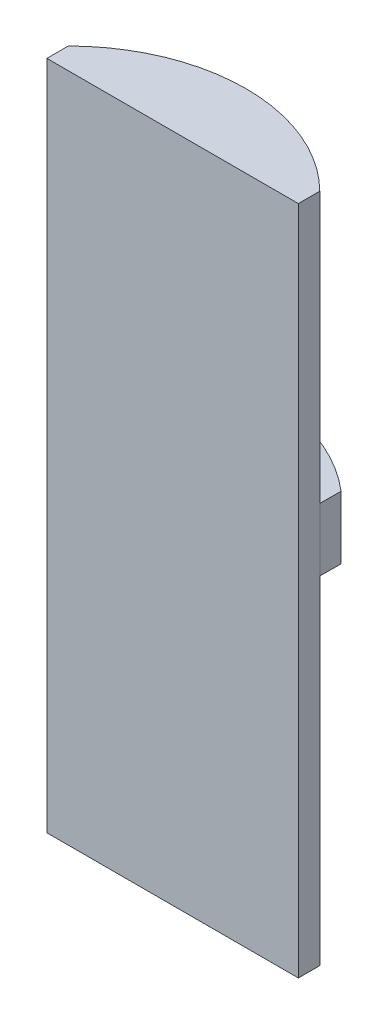
from build123d import *

# Parameters (mm, degrees)
BOSS_EXTRUDE1_DEPTH = 29
BOSS_EXTRUDE3_START = -3
BOSS_EXTRUDE3_DEPTH = 3
BOSS_EXTRUDE4_DEPTH = 29
SKETCH6_W           = 15.595785808
SKETCH6_H           = 9.872798586
CUT_EXTRUDE1_DEPTH  = 2
BOSS_EXTRUDE5_DEPTH = 5


with BuildPart() as part:
    # Sketch2 → Boss-Extrude1 (new body)
    with BuildSketch(Plane(origin=(0, 0, 0), x_dir=(1, 0, 0), z_dir=(0, 1, 0))):
        with BuildLine():
            Line((-6, 6.020797289), (-6, 5))
            Line((-6, 5), (-5.921359641, 5))
            ThreePointArc((-5.921359641, 5), (0, 7.75), (5.921359641, 5))
            Line((5.921359641, 5), (6, 5))
            Line((6, 5), (6, 6.020797289))
            ThreePointArc((6, 6.020797289), (0, 8.5), (-6, 6.020797289))
        make_face()
    extrude(amount=BOSS_EXTRUDE1_DEPTH)

    # Sketch4 → Boss-Extrude3 (add)
    with BuildSketch(Plane(origin=(0, 21.1, 0), x_dir=(1, 0, 0), z_dir=(0, 1, 0)).offset(BOSS_EXTRUDE3_START)):
        with BuildLine():
            Line((6, 6.020797289), (6.006787511, 7.03427351))
            ThreePointArc((6.006787511, 7.03427351), (0.004460918, 9.249998925), (-6, 7.040063921))
            Line((-6, 7.040063921), (-6, 6.020797289))
            ThreePointArc((-6, 6.020797289), (0, 8.5), (6, 6.020797289))
        make_face()
    extrude(amount=BOSS_EXTRUDE3_DEPTH)

    # Sketch5 → Boss-Extrude4 (add)
    with BuildSketch(Plane.XZ):
        with BuildLine():
            Line((-5.921359641, -5), (5.921359641, -5))
            ThreePointArc((5.921359641, -5), (0, -7.75), (-5.921359641, -5))
        make_face()
    extrude(amount=-BOSS_EXTRUDE4_DEPTH)

    # Sketch6 → Cut-Extrude1 (cut)
    with BuildSketch(Plane.XZ):
        with Locations((-0.763992961, -6.245386966)):
            Rectangle(SKETCH6_W, SKETCH6_H)
    extrude(amount=-CUT_EXTRUDE1_DEPTH, mode=Mode.SUBTRACT)

    # Sketch7 → Boss-Extrude5 (add)
    with BuildSketch(Plane(origin=(0, 29, 0), x_dir=(1, 0, 0), z_dir=(0, 1, 0))):
        with BuildLine():
            Line((-6, 5), (6, 5))
            Line((6, 5), (6, 6.020797289))
            ThreePointArc((6, 6.020797289), (0, 8.5), (-6, 6.020797289))
            Line((-6, 6.020797289), (-6, 5))
        make_face()
    extrude(amount=BOSS_EXTRUDE5_DEPTH)


solid = part.part
